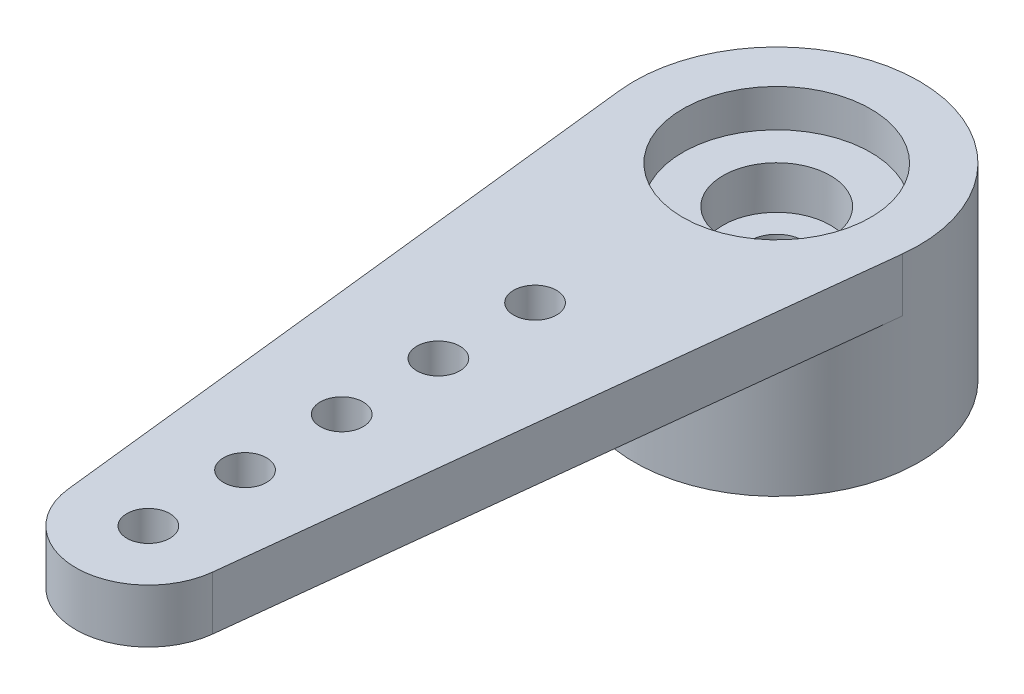
from build123d import *

# Parameters (mm, degrees)
BOSS_EXTRUDE1_DEPTH = 1.27
BOSS_EXTRUDE2_START = 3.175
SKETCH2_R           = 3.3655
BOSS_EXTRUDE2_DEPTH = 3.175
CUT_EXTRUDE1_DEPTH  = 2.286
CUT_EXTRUDE2_START  = -0.889
SKETCH4_R           = 2.2225
CUT_EXTRUDE2_DEPTH  = 0.889
CUT_EXTRUDE3_REACH  = 19.282
SKETCH5_R           = 1.27
CUT_EXTRUDE4_REACH  = 19.486
SKETCH6_R           = 0.508
SKETCH7_R           = 2.54
SKETCH7_R_2         = 0.635
BOSS_EXTRUDE3_DEPTH = 2.54


with BuildPart() as part:
    # Sketch1 → Boss-Extrude1 (new body)
    with BuildSketch(Plane(origin=(0, 0, 0), x_dir=(1, 0, 0), z_dir=(0, 1, 0))):
        with BuildLine():
            Line((-1.703883799, -15.0495), (-3.34466079, -0.373944444))
            ThreePointArc((-3.34466079, -0.373944444), (0, 3.3655), (3.34466079, -0.373944444))
            Line((3.34466079, -0.373944444), (1.703883799, -15.0495))
            ThreePointArc((1.703883799, -15.0495), (0, -16.5735), (-1.703883799, -15.0495))
        make_face()
    extrude(amount=BOSS_EXTRUDE1_DEPTH)

    # Sketch2 → Boss-Extrude2 (add)
    with BuildSketch(Plane.XZ.offset(BOSS_EXTRUDE2_START)):
        with Locations(Location((0, 0, 0), (0, 0, 270))):
            Circle(SKETCH2_R)
    extrude(amount=-BOSS_EXTRUDE2_DEPTH)

    # Sketch3 → Cut-Extrude1 (cut)
    with BuildSketch(Plane(origin=(0, -3.175, 0), x_dir=(-1, 0, 0), z_dir=(0, -1, 0))):
        with BuildLine():
            Line((0.344662185, 2.452398872), (0.160511142, 2.216696286))
            ThreePointArc((0.160511142, 2.216696286), (0.155033763, 2.217086102), (0.149555438, 2.217462383))
            Line((0.149555438, 2.217462383), (0, 2.4765))
            Line((0, 2.4765), (-0.149555438, 2.217462383))
            ThreePointArc((-0.149555438, 2.217462383), (-0.155033763, 2.217086102), (-0.160511142, 2.216696286))
            Line((-0.160511142, 2.216696286), (-0.344662185, 2.452398872))
            Line((-0.344662185, 2.452398872), (-0.456711091, 2.175068098))
            ThreePointArc((-0.456711091, 2.175068098), (-0.462083733, 2.173933043), (-0.467453554, 2.172784717))
            Line((-0.467453554, 2.172784717), (-0.682615912, 2.38056459))
            Line((-0.682615912, 2.38056459), (-0.754977382, 2.090338586))
            ThreePointArc((-0.754977382, 2.090338586), (-0.760139769, 2.08846685), (-0.765297515, 2.086582364))
            Line((-0.765297515, 2.086582364), (-1.007283297, 2.262395326))
            Line((-1.007283297, 2.262395326), (-1.038548897, 1.964923011))
            ThreePointArc((-1.038548897, 1.964923011), (-1.043400548, 1.962351025), (-1.04824583, 1.95976706))
            Line((-1.04824583, 1.95976706), (-1.312345058, 2.10019111))
            Line((-1.312345058, 2.10019111), (-1.301906239, 1.801262445))
            ThreePointArc((-1.301906239, 1.801262445), (-1.306352723, 1.79804027), (-1.310791233, 1.794807119))
            Line((-1.310791233, 1.794807119), (-1.591863515, 1.897109063))
            Line((-1.591863515, 1.897109063), (-1.539923457, 1.602542354))
            ThreePointArc((-1.539923457, 1.602542354), (-1.543878228, 1.598732706), (-1.547823575, 1.594913299))
            Line((-1.547823575, 1.594913299), (-1.84039816, 1.657101947))
            Line((-1.84039816, 1.657101947), (-1.747967817, 1.372630599))
            ThreePointArc((-1.747967817, 1.372630599), (-1.7513539, 1.368307629), (-1.754729292, 1.363976306))
            Line((-1.754729292, 1.363976306), (-2.053111548, 1.384841225))
            Line((-2.053111548, 1.384841225), (-1.921989971, 1.116002151))
            ThreePointArc((-1.921989971, 1.116002151), (-1.92474146, 1.11125), (-1.927481199, 1.106491065))
            Line((-1.927481199, 1.106491065), (-2.225863456, 1.085626145))
            Line((-2.225863456, 1.085626145), (-2.058602777, 0.837651991))
            ThreePointArc((-2.058602777, 0.837651991), (-2.060666117, 0.832563154), (-2.062716877, 0.827469234))
            Line((-2.062716877, 0.827469234), (-2.355291463, 0.765280587))
            Line((-2.355291463, 0.765280587), (-2.155147221, 0.542997887))
            ThreePointArc((-2.155147221, 0.542997887), (-2.156482252, 0.537671413), (-2.157804118, 0.532341657))
            Line((-2.157804118, 0.532341657), (-2.4388764, 0.430039712))
            Line((-2.4388764, 0.430039712), (-2.209744176, 0.237774947))
            ThreePointArc((-2.209744176, 0.237774947), (-2.210324912, 0.23231451), (-2.210892156, 0.226852654))
            Line((-2.210892156, 0.226852654), (-2.474991383, 0.086428604))
            Line((-2.474991383, 0.086428604), (-2.221330975, -0.072076012))
            ThreePointArc((-2.221330975, -0.072076012), (-2.221146113, -0.077564131), (-2.220947692, -0.083051778))
            Line((-2.220947692, -0.083051778), (-2.462933474, -0.258864739))
            Line((-2.462933474, -0.258864739), (-2.189682092, -0.380524093))
            ThreePointArc((-2.189682092, -0.380524093), (-2.188735231, -0.385933075), (-2.187775009, -0.391339701))
            Line((-2.187775009, -0.391339701), (-2.402937366, -0.599119574))
            Line((-2.402937366, -0.599119574), (-2.115413539, -0.681565705))
            ThreePointArc((-2.115413539, -0.681565705), (-2.113723107, -0.68679027), (-2.112019773, -0.692010642))
            Line((-2.112019773, -0.692010642), (-2.296170816, -0.927713229))
            Line((-2.296170816, -0.927713229), (-1.999970867, -0.969341417))
            ThreePointArc((-1.999970867, -0.969341417), (-1.997569768, -0.974279874), (-1.995156475, -0.979212383))
            Line((-1.995156475, -0.979212383), (-2.144711912, -1.23825))
            Line((-2.144711912, -1.23825), (-1.845601037, -1.23825))
            ThreePointArc((-1.845601037, -1.23825), (-1.842536005, -1.242806228), (-1.839459725, -1.247354869))
            Line((-1.839459725, -1.247354869), (-1.951508631, -1.524685644))
            Line((-1.951508631, -1.524685644), (-1.655308682, -1.483057456))
            ThreePointArc((-1.655308682, -1.483057456), (-1.651639375, -1.487142773), (-1.647959984, -1.491219011))
            Line((-1.647959984, -1.491219011), (-1.720321454, -1.781445016))
            Line((-1.720321454, -1.781445016), (-1.432797627, -1.698998885))
            ThreePointArc((-1.432797627, -1.698998885), (-1.428595463, -1.702533775), (-1.424384577, -1.706058272))
            Line((-1.424384577, -1.706058272), (-1.455650177, -2.003530587))
            Line((-1.455650177, -2.003530587), (-1.182398796, -1.881871233))
            ThreePointArc((-1.182398796, -1.881871233), (-1.177745565, -1.884786894), (-1.173085144, -1.887691048))
            Line((-1.173085144, -1.887691048), (-1.162646325, -2.186619714))
            Line((-1.162646325, -2.186619714), (-0.908985917, -2.028115099))
            ThreePointArc((-0.908985917, -2.028115099), (-0.903972189, -2.03035478), (-0.898952943, -2.032582066))
            Line((-0.898952943, -2.032582066), (-0.847012885, -2.327148775))
            Line((-0.847012885, -2.327148775), (-0.617880661, -2.134884011))
            ThreePointArc((-0.617880661, -2.134884011), (-0.612604023, -2.136404119), (-0.607323646, -2.137911186))
            Line((-0.607323646, -2.137911186), (-0.514893302, -2.422382533))
            Line((-0.514893302, -2.422382533), (-0.314749061, -2.200099834))
            ThreePointArc((-0.314749061, -2.200099834), (-0.309312217, -2.200870783), (-0.303873485, -2.201628296))
            Line((-0.303873485, -2.201628296), (-0.172751907, -2.47046737))
            Line((-0.172751907, -2.47046737), (-0.005491228, -2.222493216))
            ThreePointArc((-0.005491228, -2.222493216), (0, -2.2225), (0.005491228, -2.222493216))
            Line((0.005491228, -2.222493216), (0.172751907, -2.47046737))
            Line((0.172751907, -2.47046737), (0.303873485, -2.201628296))
            ThreePointArc((0.303873485, -2.201628296), (0.309312217, -2.200870783), (0.314749061, -2.200099834))
            Line((0.314749061, -2.200099834), (0.514893302, -2.422382533))
            Line((0.514893302, -2.422382533), (0.607323646, -2.137911186))
            ThreePointArc((0.607323646, -2.137911186), (0.612604023, -2.136404119), (0.617880661, -2.134884011))
            Line((0.617880661, -2.134884011), (0.847012885, -2.327148775))
            Line((0.847012885, -2.327148775), (0.898952943, -2.032582066))
            ThreePointArc((0.898952943, -2.032582066), (0.903972189, -2.03035478), (0.908985917, -2.028115099))
            Line((0.908985917, -2.028115099), (1.162646325, -2.186619714))
            Line((1.162646325, -2.186619714), (1.173085144, -1.887691048))
            ThreePointArc((1.173085144, -1.887691048), (1.177745565, -1.884786894), (1.182398796, -1.881871233))
            Line((1.182398796, -1.881871233), (1.455650177, -2.003530587))
            Line((1.455650177, -2.003530587), (1.424384577, -1.706058272))
            ThreePointArc((1.424384577, -1.706058272), (1.428595463, -1.702533775), (1.432797627, -1.698998885))
            Line((1.432797627, -1.698998885), (1.720321454, -1.781445016))
            Line((1.720321454, -1.781445016), (1.647959984, -1.491219011))
            ThreePointArc((1.647959984, -1.491219011), (1.651639375, -1.487142773), (1.655308682, -1.483057456))
            Line((1.655308682, -1.483057456), (1.951508631, -1.524685644))
            Line((1.951508631, -1.524685644), (1.839459725, -1.247354869))
            ThreePointArc((1.839459725, -1.247354869), (1.842536005, -1.242806228), (1.845601037, -1.23825))
            Line((1.845601037, -1.23825), (2.144711912, -1.23825))
            Line((2.144711912, -1.23825), (1.995156475, -0.979212383))
            ThreePointArc((1.995156475, -0.979212383), (1.997569768, -0.974279874), (1.999970867, -0.969341417))
            Line((1.999970867, -0.969341417), (2.296170816, -0.927713229))
            Line((2.296170816, -0.927713229), (2.112019773, -0.692010642))
            ThreePointArc((2.112019773, -0.692010642), (2.113723107, -0.68679027), (2.115413539, -0.681565705))
            Line((2.115413539, -0.681565705), (2.402937366, -0.599119574))
            Line((2.402937366, -0.599119574), (2.187775009, -0.391339701))
            ThreePointArc((2.187775009, -0.391339701), (2.188735231, -0.385933075), (2.189682092, -0.380524093))
            Line((2.189682092, -0.380524093), (2.462933474, -0.258864739))
            Line((2.462933474, -0.258864739), (2.220947692, -0.083051778))
            ThreePointArc((2.220947692, -0.083051778), (2.221146113, -0.077564131), (2.221330975, -0.072076012))
            Line((2.221330975, -0.072076012), (2.474991383, 0.086428604))
            Line((2.474991383, 0.086428604), (2.210892156, 0.226852654))
            ThreePointArc((2.210892156, 0.226852654), (2.210324912, 0.23231451), (2.209744176, 0.237774947))
            Line((2.209744176, 0.237774947), (2.4388764, 0.430039712))
            Line((2.4388764, 0.430039712), (2.157804118, 0.532341657))
            ThreePointArc((2.157804118, 0.532341657), (2.156482252, 0.537671413), (2.155147221, 0.542997887))
            Line((2.155147221, 0.542997887), (2.355291463, 0.765280587))
            Line((2.355291463, 0.765280587), (2.062716877, 0.827469234))
            ThreePointArc((2.062716877, 0.827469234), (2.060666117, 0.832563154), (2.058602777, 0.837651991))
            Line((2.058602777, 0.837651991), (2.225863456, 1.085626145))
            Line((2.225863456, 1.085626145), (1.927481199, 1.106491065))
            ThreePointArc((1.927481199, 1.106491065), (1.92474146, 1.11125), (1.921989971, 1.116002151))
            Line((1.921989971, 1.116002151), (2.053111548, 1.384841225))
            Line((2.053111548, 1.384841225), (1.754729292, 1.363976306))
            ThreePointArc((1.754729292, 1.363976306), (1.7513539, 1.368307629), (1.747967817, 1.372630599))
            Line((1.747967817, 1.372630599), (1.84039816, 1.657101947))
            Line((1.84039816, 1.657101947), (1.547823575, 1.594913299))
            ThreePointArc((1.547823575, 1.594913299), (1.543878228, 1.598732706), (1.539923457, 1.602542354))
            Line((1.539923457, 1.602542354), (1.591863515, 1.897109063))
            Line((1.591863515, 1.897109063), (1.310791233, 1.794807119))
            ThreePointArc((1.310791233, 1.794807119), (1.306352723, 1.79804027), (1.301906239, 1.801262445))
            Line((1.301906239, 1.801262445), (1.312345058, 2.10019111))
            Line((1.312345058, 2.10019111), (1.04824583, 1.95976706))
            ThreePointArc((1.04824583, 1.95976706), (1.043400548, 1.962351025), (1.038548897, 1.964923011))
            Line((1.038548897, 1.964923011), (1.007283297, 2.262395326))
            Line((1.007283297, 2.262395326), (0.765297515, 2.086582364))
            ThreePointArc((0.765297515, 2.086582364), (0.760139769, 2.08846685), (0.754977382, 2.090338586))
            Line((0.754977382, 2.090338586), (0.682615912, 2.38056459))
            Line((0.682615912, 2.38056459), (0.467453554, 2.172784717))
            ThreePointArc((0.467453554, 2.172784717), (0.462083733, 2.173933043), (0.456711091, 2.175068098))
            Line((0.456711091, 2.175068098), (0.344662185, 2.452398872))
        make_face()
    extrude(amount=-CUT_EXTRUDE1_DEPTH, mode=Mode.SUBTRACT)

    # Sketch4 → Cut-Extrude2 (cut)
    with BuildSketch(Plane(origin=(0, 1.27, 0), x_dir=(1, 0, 0), z_dir=(0, 1, 0)).offset(CUT_EXTRUDE2_START)):
        with Locations(Location((0, 0, 0), (0, 0, 270))):
            Circle(SKETCH4_R)
    extrude(amount=CUT_EXTRUDE2_DEPTH, mode=Mode.SUBTRACT)

    # Sketch5 → Cut-Extrude3 (cut, up to next)
    with BuildSketch(Plane(origin=(0, 0.381, 0), x_dir=(1, 0, 0), z_dir=(0, 1, 0)), mode=Mode.PRIVATE) as cut_extrude3_sk1:
        with Locations(Location((0, 0, 0), (0, 0, 270))):
            Circle(SKETCH5_R)
    cut_extrude3_tool1 = extrude(cut_extrude3_sk1.sketch, amount=-CUT_EXTRUDE3_REACH, mode=Mode.PRIVATE) & part.part
    add(cut_extrude3_tool1.solids().sort_by_distance((0, 0.381, 0))[0], mode=Mode.SUBTRACT)

    # Sketch6 → Cut-Extrude4 (cut, up to next)
    with BuildSketch(Plane(origin=(0, 1.27, 0), x_dir=(1, 0, 0), z_dir=(0, 1, 0)), mode=Mode.PRIVATE) as cut_extrude4_sk1:
        with Locations(Location((0, -14.859, 0), (0, 0, 270))):
            Circle(SKETCH6_R)
    cut_extrude4_tool1 = extrude(cut_extrude4_sk1.sketch, amount=-CUT_EXTRUDE4_REACH, mode=Mode.PRIVATE) & part.part
    # Sketch6 → Cut-Extrude4 (cut, up to next)
    with BuildSketch(Plane(origin=(0, 1.27, 0), x_dir=(1, 0, 0), z_dir=(0, 1, 0)), mode=Mode.PRIVATE) as cut_extrude4_sk2:
        with Locations(Location((0, -12.573, 0), (0, 0, 270))):
            Circle(SKETCH6_R)
    cut_extrude4_tool2 = extrude(cut_extrude4_sk2.sketch, amount=-CUT_EXTRUDE4_REACH, mode=Mode.PRIVATE) & part.part
    # Sketch6 → Cut-Extrude4 (cut, up to next)
    with BuildSketch(Plane(origin=(0, 1.27, 0), x_dir=(1, 0, 0), z_dir=(0, 1, 0)), mode=Mode.PRIVATE) as cut_extrude4_sk3:
        with Locations(Location((0, -10.287, 0), (0, 0, 270))):
            Circle(SKETCH6_R)
    cut_extrude4_tool3 = extrude(cut_extrude4_sk3.sketch, amount=-CUT_EXTRUDE4_REACH, mode=Mode.PRIVATE) & part.part
    # Sketch6 → Cut-Extrude4 (cut, up to next)
    with BuildSketch(Plane(origin=(0, 1.27, 0), x_dir=(1, 0, 0), z_dir=(0, 1, 0)), mode=Mode.PRIVATE) as cut_extrude4_sk4:
        with Locations(Location((0, -8.001, 0), (0, 0, 270))):
            Circle(SKETCH6_R)
    cut_extrude4_tool4 = extrude(cut_extrude4_sk4.sketch, amount=-CUT_EXTRUDE4_REACH, mode=Mode.PRIVATE) & part.part
    # Sketch6 → Cut-Extrude4 (cut, up to next)
    with BuildSketch(Plane(origin=(0, 1.27, 0), x_dir=(1, 0, 0), z_dir=(0, 1, 0)), mode=Mode.PRIVATE) as cut_extrude4_sk5:
        with Locations(Location((0, -5.715, 0), (0, 0, 270))):
            Circle(SKETCH6_R)
    cut_extrude4_tool5 = extrude(cut_extrude4_sk5.sketch, amount=-CUT_EXTRUDE4_REACH, mode=Mode.PRIVATE) & part.part
    add(cut_extrude4_tool1.solids().sort_by_distance((0, 1.27, 14.859))[0], mode=Mode.SUBTRACT)
    add(cut_extrude4_tool2.solids().sort_by_distance((0, 1.27, 12.573))[0], mode=Mode.SUBTRACT)
    add(cut_extrude4_tool3.solids().sort_by_distance((0, 1.27, 10.287))[0], mode=Mode.SUBTRACT)
    add(cut_extrude4_tool4.solids().sort_by_distance((0, 1.27, 8.001))[0], mode=Mode.SUBTRACT)
    add(cut_extrude4_tool5.solids().sort_by_distance((0, 1.27, 5.715))[0], mode=Mode.SUBTRACT)

    # Sketch7 → Boss-Extrude3 (add)
    with BuildSketch(Plane.XZ.offset(3.175)):
        Circle(SKETCH7_R)
        with Locations(Location((0, 0, 0), (0, 0, 270))):
            Circle(SKETCH7_R_2, mode=Mode.SUBTRACT)
    extrude(amount=-BOSS_EXTRUDE3_DEPTH)


solid = part.part
